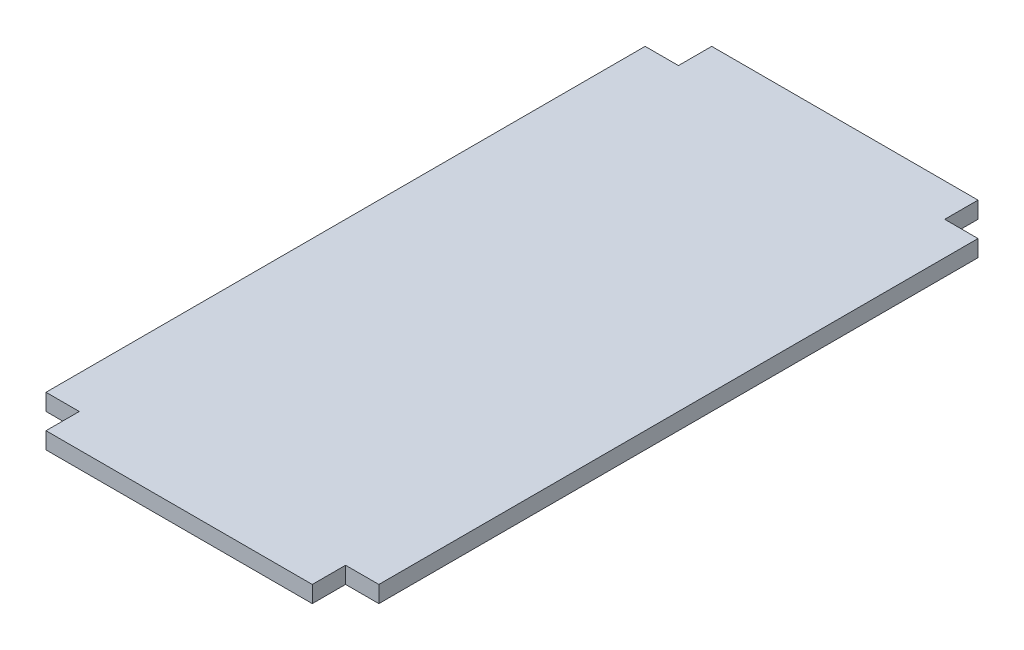
from build123d import *

# Parameters (mm, degrees)
BOSS_EXTRUDE1_DEPTH = 19.05


with BuildPart() as part:
    # Sketch1 → Boss-Extrude1 (new body)
    with BuildSketch(Plane(origin=(0, 0, 0), x_dir=(1, 0, 0), z_dir=(0, 1, 0))):
        Polygon((-194.750523985, -920.183896908), (-194.750523985, -234.383896908), (-156.650523985, -234.383896908), (-156.650523985, -196.283896908), (148.149476015, -196.283896908), (148.149476015, -234.383896908), (186.249476015, -234.383896908), (186.249476015, -920.183896908), (148.149476015, -920.183896908), (148.149476015, -958.283896908), (-156.650523985, -958.283896908), (-156.650523985, -920.183896908), align=None)
    extrude(amount=BOSS_EXTRUDE1_DEPTH)


solid = part.part
